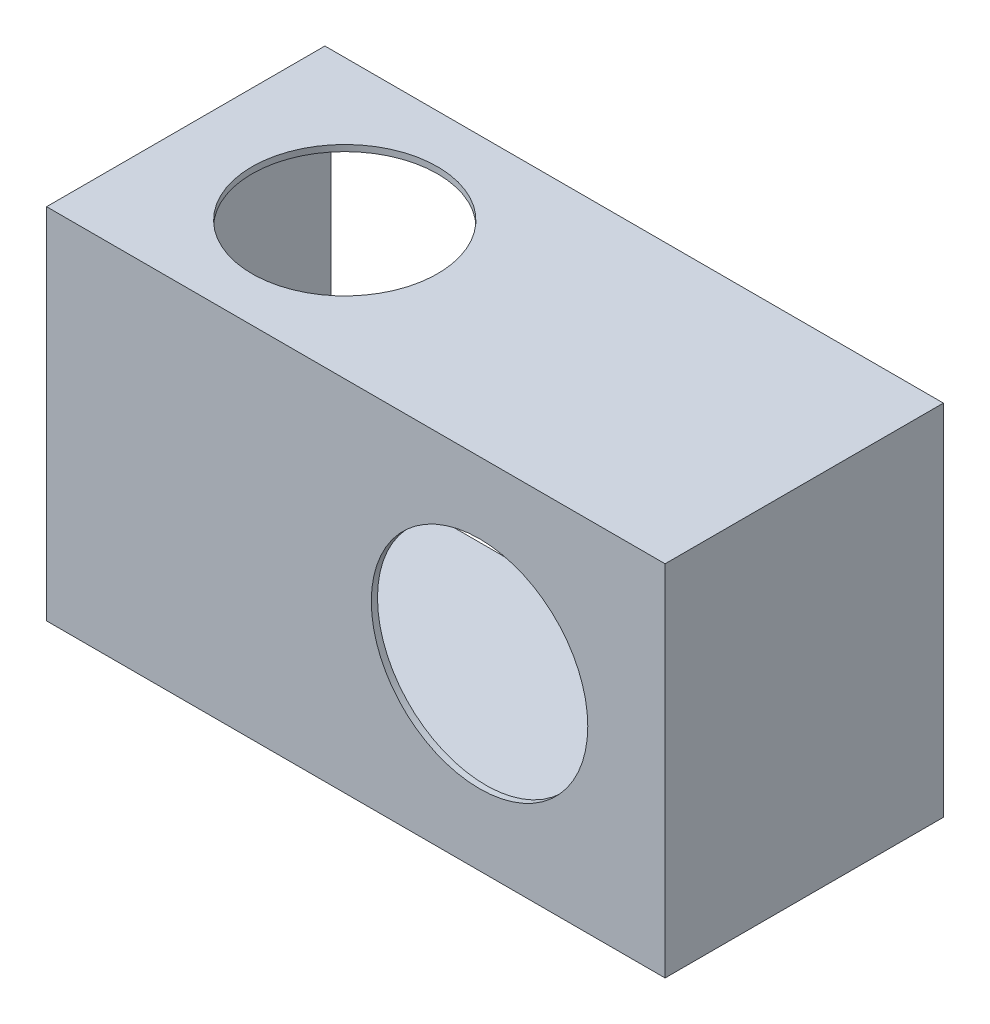
from build123d import *

# Parameters (mm, degrees)
SKETCH1_W           = 200
SKETCH1_H           = 116
BOSS_EXTRUDE1_DEPTH = 90
SHELL1_T            = -2
SKETCH2_R           = 35
CUT_EXTRUDE1_DEPTH  = 10
SKETCH3_R           = 30
CUT_EXTRUDE2_DEPTH  = 10


with BuildPart() as part:
    # Sketch1 → Boss-Extrude1 (new body)
    with BuildSketch(Plane.XY):
        with Locations((-123.252218957, -176.05574429)):
            Rectangle(SKETCH1_W, SKETCH1_H)
    extrude(amount=BOSS_EXTRUDE1_DEPTH)

    # Shell1
    shell1_openings = [part.faces().sort_by_distance(p)[0] for p in [
        (-123.252218957, -176.05574429, 0),
    ]]
    offset(amount=SHELL1_T, openings=shell1_openings, kind=Kind.INTERSECTION)

    # Sketch2 → Cut-Extrude1 (cut)
    with BuildSketch(Plane(origin=(0, 0, 88), x_dir=(-1, 0, 0), z_dir=(0, 0, -1))):
        with Locations((83.252218957, -176.05574429)):
            Circle(SKETCH2_R)
    extrude(amount=-CUT_EXTRUDE1_DEPTH, mode=Mode.SUBTRACT)

    # Sketch3 → Cut-Extrude2 (cut)
    with BuildSketch(Plane(origin=(0, -118.05574429, 0), x_dir=(1, 0, 0), z_dir=(0, 1, 0))):
        with Locations(Location((-171.255446698, -45.579189532, 0), (0, 0, 180))):
            Circle(SKETCH3_R)
    extrude(amount=-CUT_EXTRUDE2_DEPTH, mode=Mode.SUBTRACT)


solid = part.part
